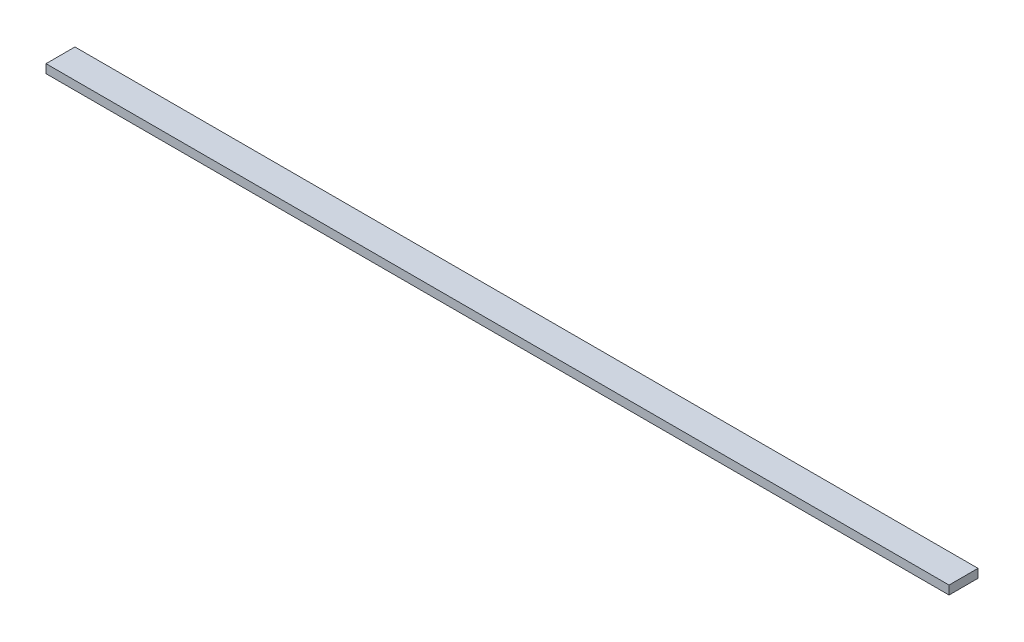
from build123d import *

# Parameters (mm, degrees)
SKETCH_1_W      = 1872
SKETCH_1_H      = 60
EXTRUDE_1_DEPTH = 18


with BuildPart() as part:
    # 草图1 → 凸台-拉伸1 (new body)
    with BuildSketch(Plane(origin=(0, 0, 0), x_dir=(1, 0, 0), z_dir=(0, 1, 0))):
        with Locations((528.500417014, 188.582151793)):
            Rectangle(SKETCH_1_W, SKETCH_1_H)
    extrude(amount=EXTRUDE_1_DEPTH)


solid = part.part
